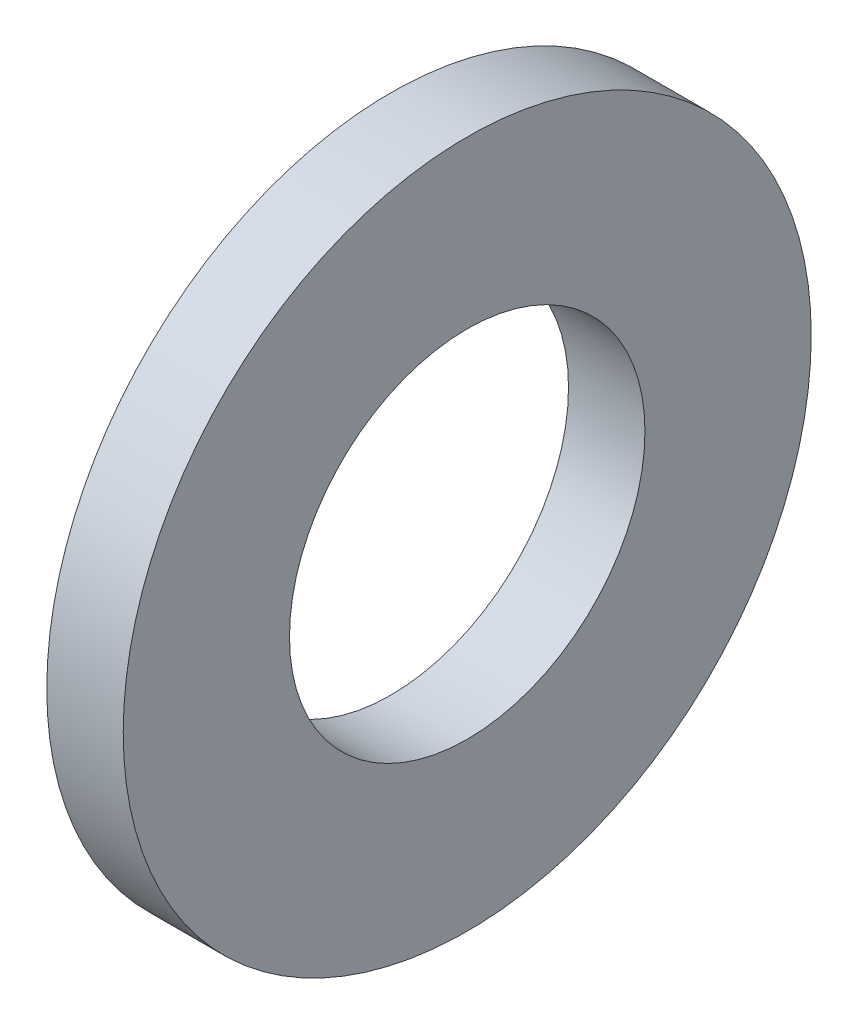
from build123d import *

# Parameters (mm, degrees)
SKETCH1_R          = 9
SKETCH1_R_2        = 4.65
BASE_EXTRUDE_DEPTH = 2


with BuildPart() as part:
    # Sketch1 → Base-Extrude (new body)
    with BuildSketch(Plane(origin=(0, 0, 0), x_dir=(0, 0, -1), z_dir=(1, 0, 0))):
        Circle(SKETCH1_R)
        Circle(SKETCH1_R_2, mode=Mode.SUBTRACT)
    extrude(amount=BASE_EXTRUDE_DEPTH)


solid = part.part
